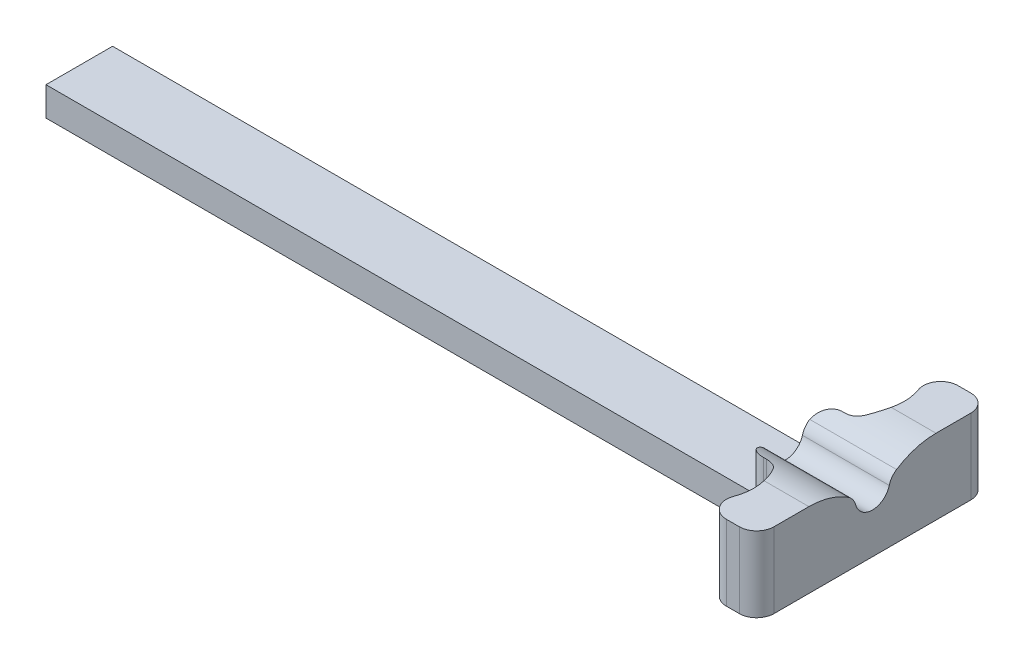
from build123d import *

# Parameters (mm, degrees)
EXTRUDE_1_DEPTH     = 13
EXTRUDE_2_DEPTH     = 5
CUT_EXTRUDE_1_DEPTH = 140.061137634


with BuildPart() as part:
    # 草图1 → 凸台-拉伸1 (new body)
    with BuildSketch(Plane(origin=(0, 0, 0), x_dir=(1, 0, 0), z_dir=(0, 1, 0))):
        with BuildLine():
            Line((122, 3.83772234), (122, -3.83772234))
            ThreePointArc((122, -3.83772234), (122.878679656, -5.959042683), (125, -6.83772234))
            Line((125, -6.83772234), (125.5, -6.83772234))
            ThreePointArc((125.5, -6.83772234), (126.882997438, -7.175520603), (127.954545455, -8.112843616))
            ThreePointArc((127.954545455, -8.112843616), (129.429754152, -11.909474928), (128.969252111, -15.956521739))
            ThreePointArc((128.969252111, -15.956521739), (129.319163119, -18.713120722), (131.781929326, -20))
            Line((131.781929326, -20), (134, -20))
            ThreePointArc((134, -20), (136.121320344, -19.121320344), (137, -17))
            Line((137, -17), (137, 17))
            ThreePointArc((137, 17), (136.121320344, 19.121320344), (134, 20))
            Line((134, 20), (131.781929326, 20))
            ThreePointArc((131.781929326, 20), (129.319163119, 18.713120722), (128.969252111, 15.956521739))
            ThreePointArc((128.969252111, 15.956521739), (129.429754152, 11.909474928), (127.954545455, 8.112843616))
            ThreePointArc((127.954545455, 8.112843616), (126.882997438, 7.175520603), (125.5, 6.83772234))
            Line((125.5, 6.83772234), (125, 6.83772234))
            ThreePointArc((125, 6.83772234), (122.878679656, 5.959042683), (122, 3.83772234))
        make_face()
    extrude(amount=EXTRUDE_1_DEPTH)

    # 草图1<3> → 凸台-拉伸2 (add)
    with BuildSketch(Plane(origin=(0, 0, 0), x_dir=(1, 0, 0), z_dir=(0, 1, 0))):
        with BuildLine():
            Line((0, 5.75), (0, -5.75))
            Line((0, -5.75), (122.68846498, -5.75))
            ThreePointArc((122.68846498, -5.75), (122.177358944, -4.853939575), (122, -3.83772234))
            Line((122, -3.83772234), (122, 3.83772234))
            ThreePointArc((122, 3.83772234), (122.177358944, 4.853939575), (122.68846498, 5.75))
            Line((122.68846498, 5.75), (0, 5.75))
        make_face()
    extrude(amount=EXTRUDE_2_DEPTH)

    # 草图2 → 切除-拉伸1 (cut, through all)
    with BuildSketch(Plane(origin=(137, 0, 0), x_dir=(0, 0, -1), z_dir=(1, 0, 0))):
        with BuildLine():
            Line((-10.979609429, 13), (10.979609429, 13))
            ThreePointArc((10.979609429, 13), (7.425251062, 12.484011707), (4.164333864, 10.978645856))
            ThreePointArc((4.164333864, 10.978645856), (3.369802513, 10.222787671), (2.9, 9.231885425))
            ThreePointArc((2.9, 9.231885425), (0, 7), (-2.9, 9.231885425))
            ThreePointArc((-2.9, 9.231885425), (-3.369802513, 10.222787671), (-4.164333864, 10.978645856))
            ThreePointArc((-4.164333864, 10.978645856), (-7.425251062, 12.484011707), (-10.979609429, 13))
        make_face()
    extrude(amount=-CUT_EXTRUDE_1_DEPTH, mode=Mode.SUBTRACT)


solid = part.part
